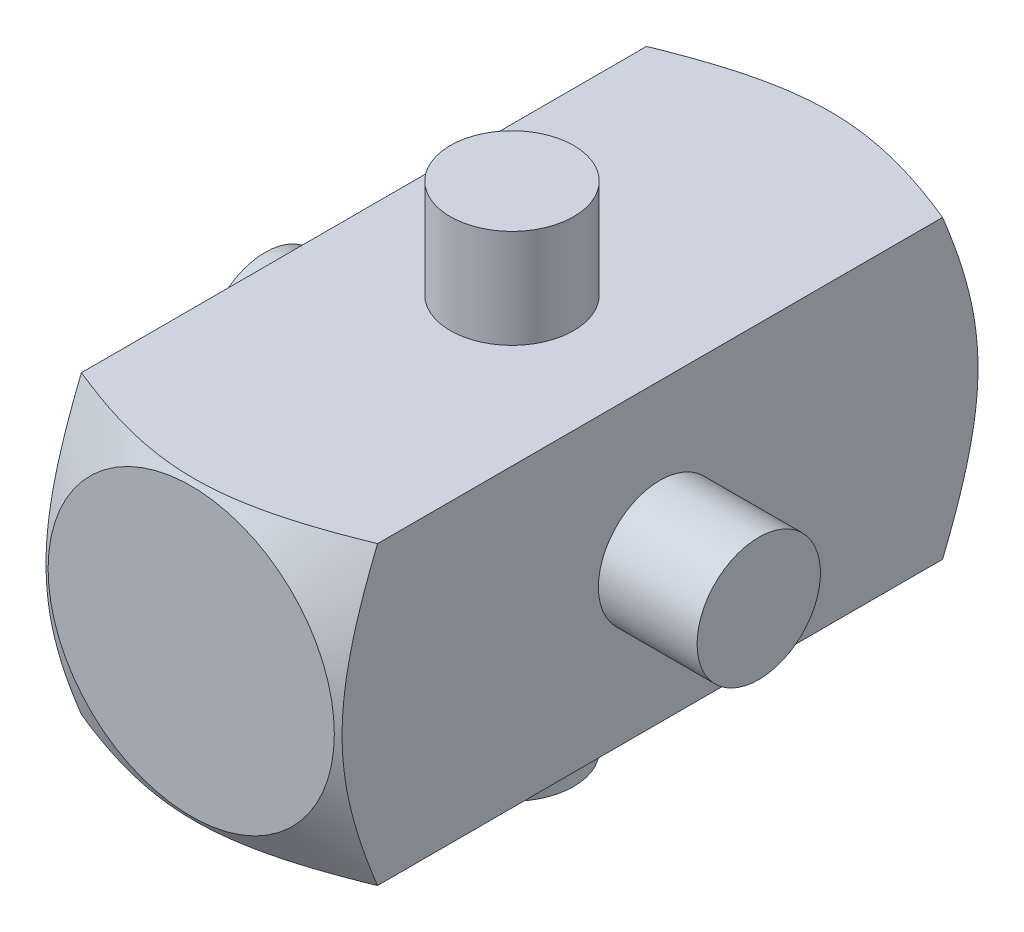
from build123d import *

# Parameters (mm, degrees)
SKETCH1_W           = 7.62
SKETCH1_H           = 7.62
BOSS_EXTRUDE1_DEPTH = 8.255
SKETCH3_R           = 1.5875
BOSS_EXTRUDE2_DEPTH = 6.35
SKETCH4_R           = 1.5875
BOSS_EXTRUDE3_DEPTH = 6.35


with BuildPart() as part:
    # Sketch1 → Boss-Extrude1 (new, symmetric)
    with BuildSketch(Plane.XY):
        Rectangle(SKETCH1_W, SKETCH1_H)
    extrude(amount=BOSS_EXTRUDE1_DEPTH, both=True)

    # Sketch2 → Cut-Revolve2 (revolve, cut)
    with BuildSketch(Plane(origin=(0, 0, 0), x_dir=(-1, 0, 0), z_dir=(0, -1, 0)), mode=Mode.PRIVATE) as cut_revolve2_sk:
        Polygon((-3.683, 8.255), (-12.573, 8.255), (-12.573, -8.255), (-3.683, -8.255), (-11.303, -3.855590949), (-11.303, 3.855590949), align=None)
    revolve(cut_revolve2_sk.sketch.rotate(Axis((0, 0, -8.255), (0, 0, 1)), 180), axis=Axis((0, 0, -8.255), (0, 0, 1)), mode=Mode.SUBTRACT)

    # Sketch3 → Boss-Extrude2 (add, symmetric)
    with BuildSketch(Plane.XZ):
        with Locations(Location((0, 0, 0), (0, 0, 90))):
            Circle(SKETCH3_R)
    extrude(amount=BOSS_EXTRUDE2_DEPTH, both=True)

    # Sketch4 → Boss-Extrude3 (add, symmetric)
    with BuildSketch(Plane.ZY):
        with Locations(Location((0, 0, 0), (0, 0, 180))):
            Circle(SKETCH4_R)
    extrude(amount=BOSS_EXTRUDE3_DEPTH, both=True)


solid = part.part
